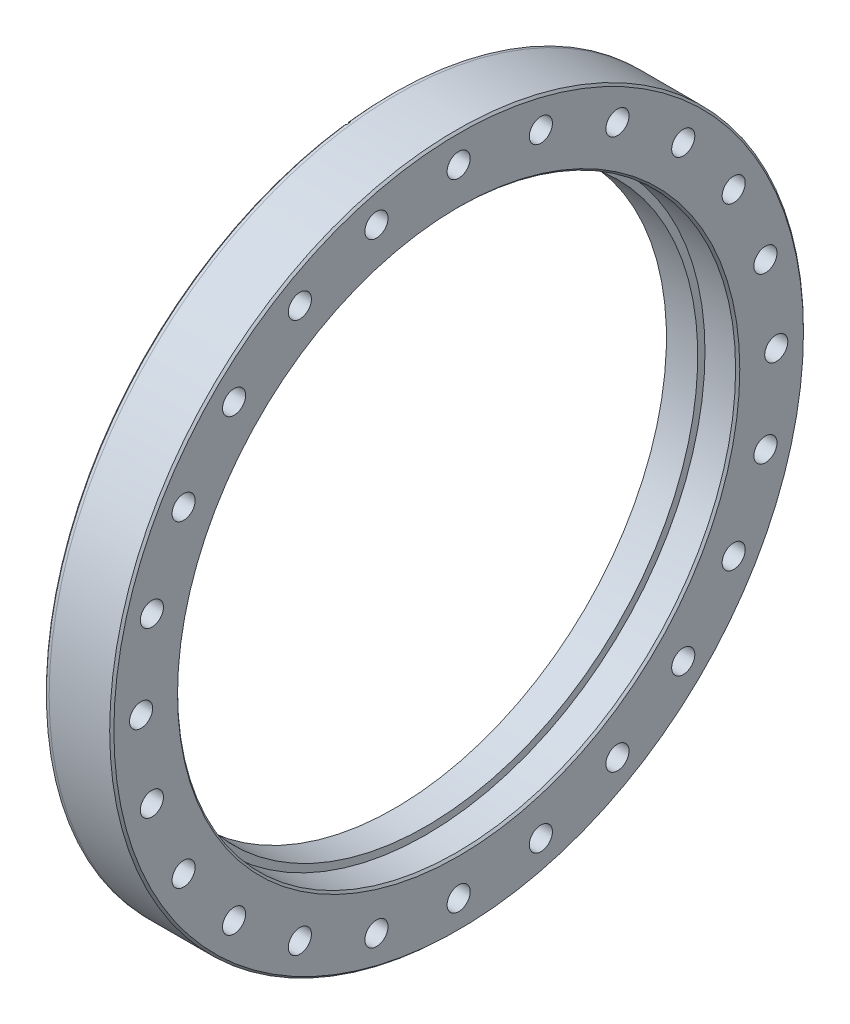
from build123d import *

# Parameters (mm, degrees)
HOLE1_D           = 8.4328
CIRPATTERN1_COUNT = 24
EXTRUDE1_DEPTH    = 1.016


with BuildPart() as part:
    # Sketch1 → Revolve1 (revolve)
    with BuildSketch(Plane.XY):
        Polygon((255.900825698, 390.490656873), (255.900825698, 381.245056873), (267.330825698, 381.245056873), (267.330825698, 383.886656873), (278.506825698, 383.886656873), (279.268825698, 384.648656873), (279.268825698, 407.889656873), (278.506825698, 408.651656873), (256.409254981, 408.651656873), (255.392825698, 408.649168915), (254.630825698, 407.887153851), (254.630825698, 393.154822015), (255.59724885, 393.157656873), (256.261934313, 393.157656873), (255.291225698, 390.490656873), align=None)
    revolve(axis=Axis((234.51052404, 282.032656873, 0), (1, 0, 0)))

    # Hole1 (through all)
    with Locations(Plane(origin=(254.630825698, 397.958256873, 0), x_dir=(0, 0, -1), z_dir=(-1, 0, 0))):
        with Locations((0, 0)):
            hole1 = Hole(HOLE1_D / 2)

    # CirPattern1: Hole1 ×24 about axis
    cirpattern1_axis = Axis((267.330825698, 282.032656873, 0), (-1, 0, 0))
    for i in range(1, CIRPATTERN1_COUNT):
        add(hole1.rotate(cirpattern1_axis, i * 360 / CIRPATTERN1_COUNT), mode=Mode.SUBTRACT)

    # Sketch5 → Extrude1 (cut)
    with BuildSketch(Plane.ZY.offset(-254.630825698)):
        Polygon((17.293788017, 413.392018325), (18.080747375, 413.28841316), (15.154326219, 391.060037623), (13.580407501, 391.267247953), (16.506828658, 413.49562349), align=None)
        Polygon((-19.417001089, 128.464736046), (-20.990919806, 128.671946376), (-15.132677091, 173.169717573), (-13.558758374, 172.962507243), align=None)
    extrude(amount=-EXTRUDE1_DEPTH, mode=Mode.SUBTRACT)


solid = part.part
